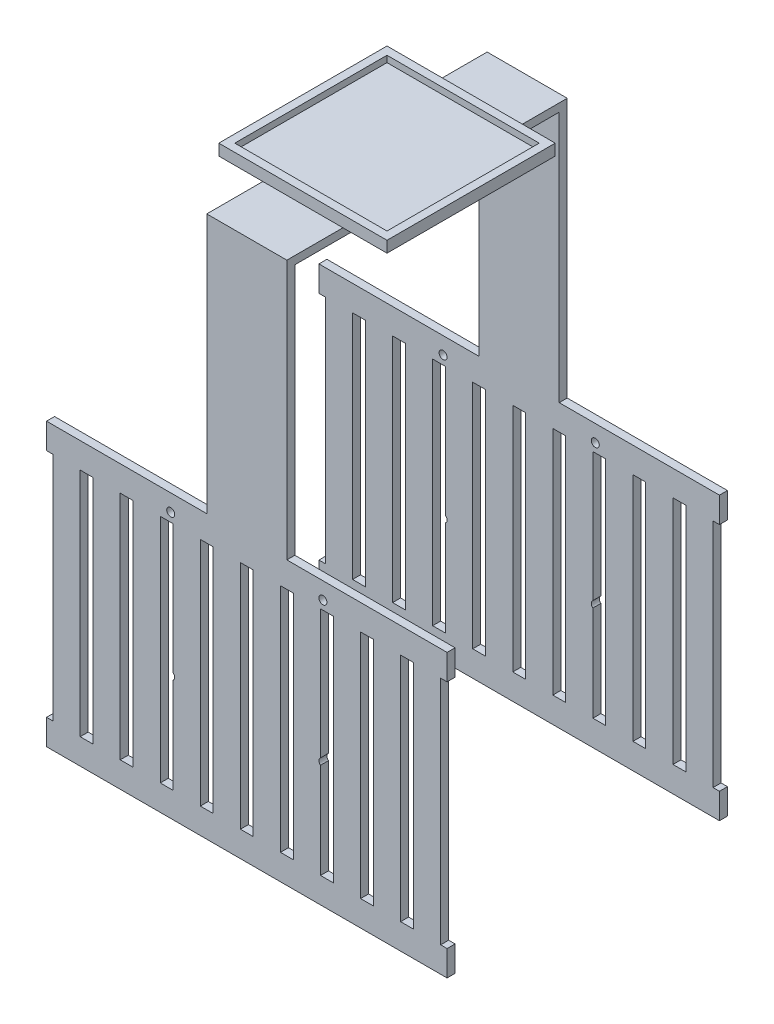
from build123d import *

# Parameters (mm, degrees)
ESQUISSE1_R                    = 2.5
BOSS_EXTRU_1_DEPTH             = 5
ESQUISSE2_W                    = 50
ESQUISSE2_H                    = 175
BOSS_EXTRU_2_DEPTH             = 5
ESQUISSE3_R                    = 2.5
BOSS_EXTRU_3_DEPTH             = 5
ESQUISSE4_W                    = 105
ESQUISSE4_H                    = 105
BOSS_EXTRU_4_DEPTH             = 3
ESQUISSE5_W                    = 105
ESQUISSE5_H                    = 105
ESQUISSE5_W_2                  = 95
ESQUISSE5_H_2                  = 95
BOSS_EXTRU_5_DEPTH             = 4
ESQUISSE6_W                    = 250
ESQUISSE6_H                    = 176
ESQUISSE6_R                    = 2.5
ESQUISSE6_R_2                  = 2.502271874
ESQUISSE6_R_3                  = 2.696378283
BOSS_EXTRU_6_DEPTH             = 5
BOSS_EXTRU_7_START             = -5
ESQUISSE8_W                    = 250
ESQUISSE8_H                    = 176
ESQUISSE8_R                    = 2.696378283
ESQUISSE8_R_2                  = 2.502271874
ESQUISSE8_R_3                  = 2.5
BOSS_EXTRU_7_DEPTH             = 5
ESQUISSE9_W                    = 8
ESQUISSE9_H                    = 144.140424184
ENL_V_MAT_EXTRU_1_DEPTH        = 296
R_P_TITION_LIN_AIRE1_COUNT     = 6
R_P_TITION_LIN_AIRE1_PITCH     = 25
R_P_TITION_LIN_AIRE1_COL_COUNT = 6
R_P_TITION_LIN_AIRE1_COL_PITCH = 25


with BuildPart() as part:
    # Esquisse1 → Boss.-Extru.1 (new body)
    with BuildSketch(Plane.XY):
        Polygon((-62.5, 88), (-62.5, -88), (62.5, -88), (62.5, 88), (25, 88), (25, 250.03), (-25, 250.03), (-25, 88), align=None)
        with Locations((-47.5, 77.5)):
            Circle(ESQUISSE1_R, mode=Mode.SUBTRACT)
        with Locations((-47.5, -10.5)):
            Circle(ESQUISSE1_R, mode=Mode.SUBTRACT)
        with Locations(Location((47.5, -10.5, 0), (0, 0, 180))):
            Circle(ESQUISSE1_R, mode=Mode.SUBTRACT)
        with Locations(Location((47.5, 77.5, 0), (0, 0, 180))):
            Circle(ESQUISSE1_R, mode=Mode.SUBTRACT)
    extrude(amount=BOSS_EXTRU_1_DEPTH)

    # Esquisse2 → Boss.-Extru.2 (add)
    with BuildSketch(Plane(origin=(0, 250.03, 0), x_dir=(1, 0, 0), z_dir=(0, 1, 0))):
        with Locations((0, 82.5)):
            Rectangle(ESQUISSE2_W, ESQUISSE2_H)
    extrude(amount=-BOSS_EXTRU_2_DEPTH)

    # Esquisse3 → Boss.-Extru.3 (add)
    with BuildSketch(Plane(origin=(0, 0, -170), x_dir=(-1, 0, 0), z_dir=(0, 0, -1))):
        Polygon((25, 88), (25, 250.03), (-25, 250.03), (-25, 88), (-62.5, 88), (-62.5, -88), (62.5, -88), (62.5, 88), align=None)
        with Locations(Location((47.5, -10.5, 0), (0, 0, 180))):
            Circle(ESQUISSE3_R, mode=Mode.SUBTRACT)
        with Locations(Location((47.5, 77.5, 0), (0, 0, 180))):
            Circle(ESQUISSE3_R, mode=Mode.SUBTRACT)
        with Locations((-47.5, 77.5)):
            Circle(ESQUISSE3_R, mode=Mode.SUBTRACT)
        with Locations((-47.5, -10.5)):
            Circle(ESQUISSE3_R, mode=Mode.SUBTRACT)
    extrude(amount=-BOSS_EXTRU_3_DEPTH)

    # Esquisse4 → Boss.-Extru.4 (add)
    with BuildSketch(Plane(origin=(0, 250.03, 0), x_dir=(1, 0, 0), z_dir=(0, 1, 0))):
        with Locations((0, 82.5)):
            Rectangle(ESQUISSE4_W, ESQUISSE4_H)
    extrude(amount=BOSS_EXTRU_4_DEPTH)

    # Esquisse5 → Boss.-Extru.5 (add)
    with BuildSketch(Plane(origin=(0, 253.03, 0), x_dir=(1, 0, 0), z_dir=(0, 1, 0))):
        with Locations((0, 82.5)):
            Rectangle(ESQUISSE5_W, ESQUISSE5_H)
        with Locations((0, 82.5)):
            Rectangle(ESQUISSE5_W_2, ESQUISSE5_H_2, mode=Mode.SUBTRACT)
    extrude(amount=BOSS_EXTRU_5_DEPTH)

    # Esquisse6 → Boss.-Extru.6 (add)
    with BuildSketch(Plane(origin=(0, 0, -170), x_dir=(-1, 0, 0), z_dir=(0, 0, -1))):
        Rectangle(ESQUISSE6_W, ESQUISSE6_H)
        with Locations((-47.5, 77.5)):
            Circle(ESQUISSE6_R, mode=Mode.SUBTRACT)
        with Locations((47.5, 77.5)):
            Circle(ESQUISSE6_R_2, mode=Mode.SUBTRACT)
        with Locations((-47.5, -10.5)):
            Circle(ESQUISSE6_R_3, mode=Mode.SUBTRACT)
        with Locations((47.5, -10.5)):
            Circle(ESQUISSE6_R_3, mode=Mode.SUBTRACT)
    extrude(amount=-BOSS_EXTRU_6_DEPTH)

    # Esquisse8 → Boss.-Extru.7 (add)
    with BuildSketch(Plane.XY.offset(5).offset(BOSS_EXTRU_7_START)):
        Rectangle(ESQUISSE8_W, ESQUISSE8_H)
        with Locations((47.5, -10.5)):
            Circle(ESQUISSE8_R, mode=Mode.SUBTRACT)
        with Locations((-47.5, 77.5)):
            Circle(ESQUISSE8_R_2, mode=Mode.SUBTRACT)
        with Locations(Location((47.5, 77.5, 0), (0, 0, 180))):
            Circle(ESQUISSE8_R_3, mode=Mode.SUBTRACT)
        with Locations((-47.5, -10.5)):
            Circle(ESQUISSE8_R, mode=Mode.SUBTRACT)
    extrude(amount=BOSS_EXTRU_7_DEPTH)

    # Esquisse9 → Enlèv. mat.-Extru.1 (cut)
    with BuildSketch(Plane(origin=(0, 0, -170), x_dir=(-1, 0, 0), z_dir=(0, 0, -1))):
        Rectangle(ESQUISSE9_W, ESQUISSE9_H)
    enl_v_mat_extru_1 = extrude(amount=-ENL_V_MAT_EXTRU_1_DEPTH, mode=Mode.SUBTRACT)

    # Répétition linéaire1: Enlèv. mat.-Extru.1 ×6
    with Locations(*[(-i * R_P_TITION_LIN_AIRE1_PITCH, 0, 0) for i in range(1, R_P_TITION_LIN_AIRE1_COUNT)]):
        add(enl_v_mat_extru_1, mode=Mode.SUBTRACT)

    # Répétition linéaire1 col: Enlèv. mat.-Extru.1 ×6
    with Locations(*[(i * R_P_TITION_LIN_AIRE1_COL_PITCH, 0, 0) for i in range(1, R_P_TITION_LIN_AIRE1_COL_COUNT)]):
        add(enl_v_mat_extru_1, mode=Mode.SUBTRACT)


solid = part.part
